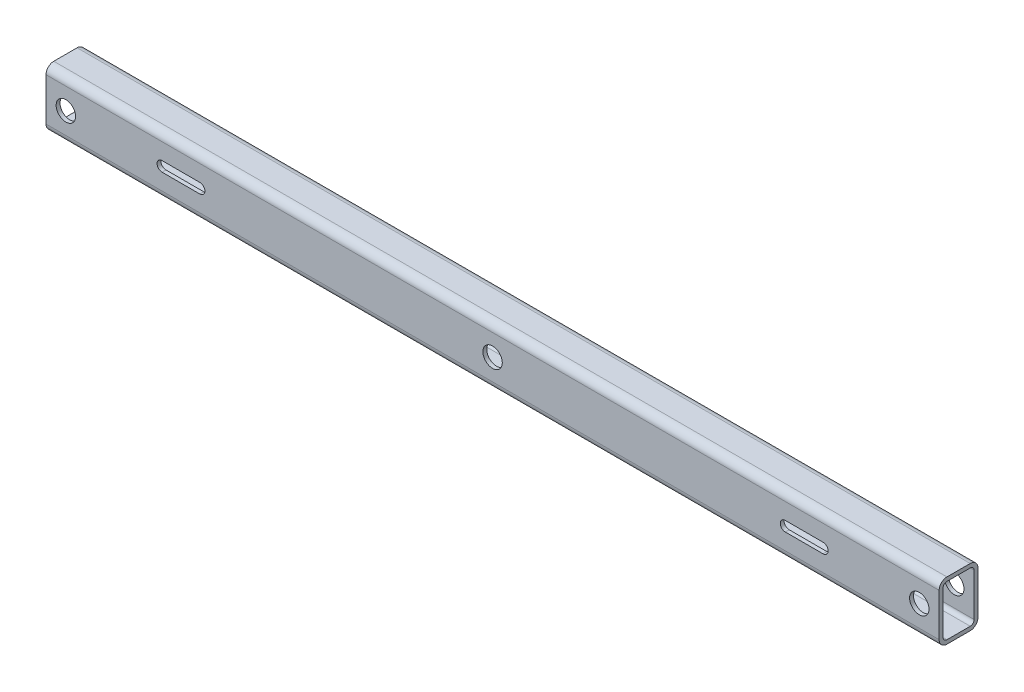
from build123d import *

# Parameters (mm, degrees)
SKETCH1_W               = 2300
SKETCH1_H               = 150
BOSS_EXTRUDE1_DEPTH     = 100
CUT_EXTRUDE1_DEPTH      = 2304.394234602
CUT_EXTRUDE1_DEPTH_BACK = 2304.394234602
SKETCH3_W               = 80
SKETCH3_H               = 130
FILLET1_R               = 10
FILLET2_R               = 20
SKETCH4_R               = 25
CUT_EXTRUDE2_DEPTH      = 1157.773530126
CUT_EXTRUDE3_DEPTH      = 1157.773530126


with BuildPart() as part:
    # Sketch1 → Boss-Extrude1 (new body)
    with BuildSketch(Plane.XY):
        Rectangle(SKETCH1_W, SKETCH1_H)
    extrude(amount=BOSS_EXTRUDE1_DEPTH)

    # Sketch3 → Cut-Extrude1 (cut, two sides: drawn at the far end of the back side and taken through both)
    with BuildSketch(Plane.ZY.offset(1150).offset(-CUT_EXTRUDE1_DEPTH_BACK)):
        with Locations((50, 0)):
            Rectangle(SKETCH3_W, SKETCH3_H)
    extrude(amount=CUT_EXTRUDE1_DEPTH + CUT_EXTRUDE1_DEPTH_BACK, mode=Mode.SUBTRACT)

    # Fillet1
    fillet1_edges = [part.edges().sort_by_distance(p)[0] for p in [
        (0, -65, 90),
        (0, -65, 10),
        (0, 65, 10),
        (0, 65, 90),
    ]]
    fillet(fillet1_edges, radius=FILLET1_R)

    # Fillet2
    fillet2_edges = [part.edges().sort_by_distance(p)[0] for p in [
        (0, 75, 100),
        (0, 75, 0),
        (0, -75, 0),
        (0, -75, 100),
    ]]
    fillet(fillet2_edges, radius=FILLET2_R)

    # Sketch4 → Cut-Extrude2 (cut, through all)
    with BuildSketch(Plane(origin=(0, 0, 0), x_dir=(-1, 0, 0), z_dir=(0, 0, -1))):
        Circle(SKETCH4_R)
        with Locations((-1098.86, 0)):
            Circle(SKETCH4_R)
        with Locations((1098.86, 0)):
            Circle(SKETCH4_R)
    extrude(amount=-CUT_EXTRUDE2_DEPTH, mode=Mode.SUBTRACT)

    # Sketch5 → Cut-Extrude3 (cut, through all)
    with BuildSketch(Plane(origin=(0, 0, 0), x_dir=(-1, 0, 0), z_dir=(0, 0, -1))):
        with BuildLine():
            Line((-851.045, 12.91), (-753.695, 12.91))
            ThreePointArc((-753.695, 12.91), (-740.785, 0), (-753.695, -12.91))
            Line((-753.695, -12.91), (-851.045, -12.91))
            ThreePointArc((-851.045, -12.91), (-863.955, 0), (-851.045, 12.91))
        make_face()
        with BuildLine():
            Line((851.045, 12.91), (753.695, 12.91))
            ThreePointArc((753.695, 12.91), (740.785, 0), (753.695, -12.91))
            Line((753.695, -12.91), (851.045, -12.91))
            ThreePointArc((851.045, -12.91), (863.955, 0), (851.045, 12.91))
        make_face()
    extrude(amount=-CUT_EXTRUDE3_DEPTH, mode=Mode.SUBTRACT)


solid = part.part
